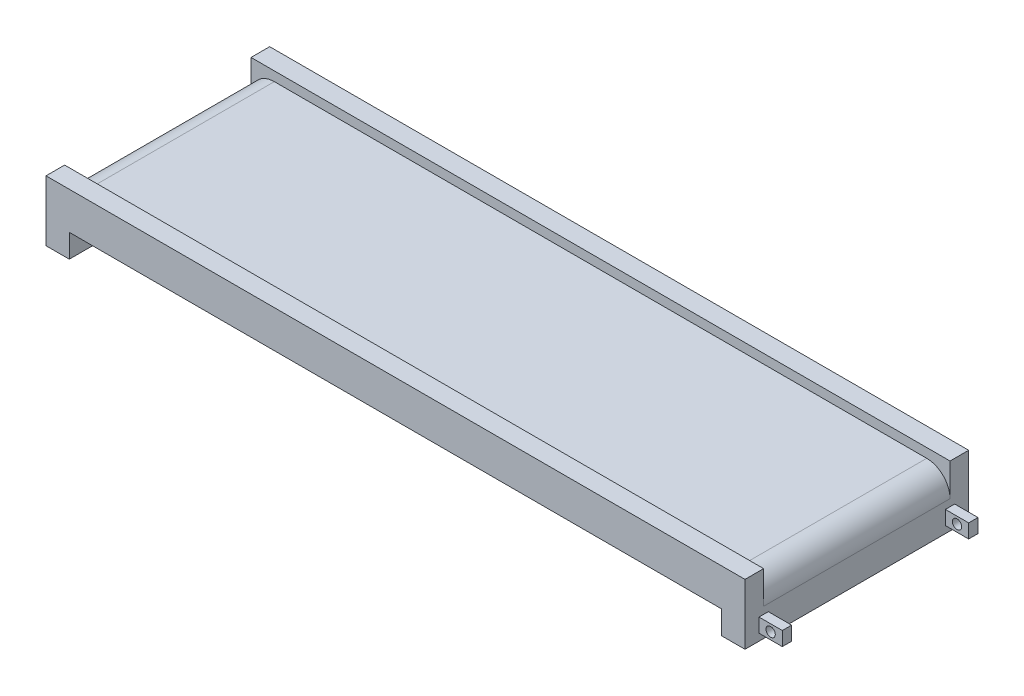
from build123d import *

# Parameters (mm, degrees)
SKETCH3_W           = 3810
SKETCH3_H           = 1219.2
BOSS_EXTRUDE2_DEPTH = 203.2
SKETCH4_W           = 3810
SKETCH4_H           = 1016
CUT_EXTRUDE1_DEPTH  = 50.8
SKETCH5_W           = 127
SKETCH5_H           = 1219.2
BOSS_EXTRUDE3_DEPTH = 127
FILLET2_R           = 127
SKETCH6_W           = 25.4
SKETCH6_H           = 38.1
BOSS_EXTRUDE4_DEPTH = 127
SKETCH7_R           = 25.4
CUT_EXTRUDE2_DEPTH  = 1270


with BuildPart() as part:
    # Sketch3 → Boss-Extrude2 (new body)
    with BuildSketch(Plane(origin=(0, 0, 0), x_dir=(1, 0, 0), z_dir=(0, 1, 0))):
        with Locations((1905, -609.6)):
            Rectangle(SKETCH3_W, SKETCH3_H)
    extrude(amount=BOSS_EXTRUDE2_DEPTH)

    # Sketch4 → Cut-Extrude1 (cut)
    with BuildSketch(Plane(origin=(0, 203.2, 0), x_dir=(1, 0, 0), z_dir=(0, 1, 0))):
        with Locations((1905, -609.6)):
            Rectangle(SKETCH4_W, SKETCH4_H)
    extrude(amount=-CUT_EXTRUDE1_DEPTH, mode=Mode.SUBTRACT)

    # Sketch5 → Boss-Extrude3 (add)
    with BuildSketch(Plane(origin=(0, 0, 0), x_dir=(-1, 0, 0), z_dir=(0, -1, 0))):
        with Locations((-63.5, -609.6)):
            Rectangle(SKETCH5_W, SKETCH5_H)
        with Locations((-3746.5, -609.6)):
            Rectangle(SKETCH5_W, SKETCH5_H)
    extrude(amount=BOSS_EXTRUDE3_DEPTH)

    # Fillet2
    fillet2_edges = [part.edges().sort_by_distance(p)[0] for p in [
        (0, 152.4, 609.6),
        (3810, 152.4, 609.6),
    ]]
    fillet(fillet2_edges, radius=FILLET2_R)

    # Sketch6 → Boss-Extrude4 (add)
    with BuildSketch(Plane(origin=(3810, 0, 0), x_dir=(0, 0, -1), z_dir=(1, 0, 0))):
        with Locations((-1104.9, -31.75)):
            Rectangle(SKETCH6_W, SKETCH6_H)
        Polygon((-1117.6, -50.8), (-1117.6, -12.7), (-1143, -12.7), (-1143, -88.9), (-1092.2, -88.9), (-1092.2, -50.8), align=None)
        Polygon((-101.6, -50.8), (-127, -50.8), (-127, -88.9), (-76.2, -88.9), (-76.2, -12.7), (-101.6, -12.7), align=None)
        with Locations((-114.3, -31.75)):
            Rectangle(SKETCH6_W, SKETCH6_H)
    extrude(amount=BOSS_EXTRUDE4_DEPTH)

    # Sketch7 → Cut-Extrude2 (cut)
    with BuildSketch(Plane.XY.offset(1143)):
        with Locations((3873.5, -50.8)):
            Circle(SKETCH7_R)
    extrude(amount=-CUT_EXTRUDE2_DEPTH, mode=Mode.SUBTRACT)


solid = part.part
